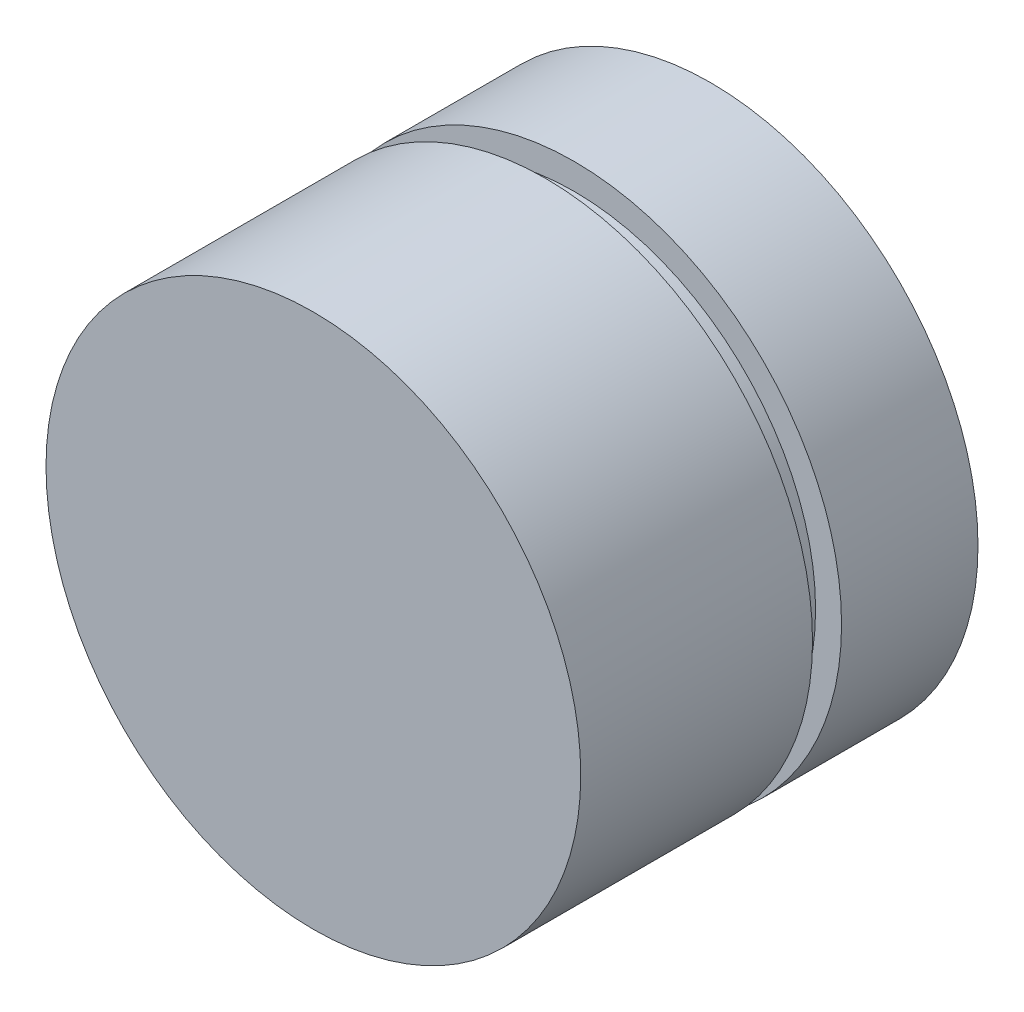
from build123d import *

# Parameters (mm, degrees)
CROQUIS8_W = 5
CROQUIS8_H = 6.1


with BuildPart() as part:
    # Croquis6 → Revolución1 (revolve)
    with BuildSketch(Plane(origin=(0, 0, 0), x_dir=(1, 0, 0), z_dir=(0, 1, 0))):
        Polygon((17.5, 15.169836957), (15.8, 15.169836957), (15.8, 17.069836957), (17.5, 17.069836957), (17.5, 26), (0, 26), (0, 0), (17.5, 0), align=None)
    revolve(axis=Axis((0, 0, 0), (0, 0, -1)))

    # Croquis7 → Cortar-Revolución1 (revolve, cut)
    with BuildSketch(Plane(origin=(0, 0, 0), x_dir=(1, 0, 0), z_dir=(0, 1, 0))):
        Polygon((0, 26.013313624), (15.6, 26.013313624), (15.6, 17.213313624), (13.88, 11.106656812), (0, 11.113313624), align=None)
    revolve(axis=Axis((0, 0, 0), (0, 0, -1)), mode=Mode.SUBTRACT)


with BuildPart() as body_2:
    # Croquis8 → Revolución4 (revolve)
    with BuildSketch(Plane(origin=(0, 0, 0), x_dir=(1, 0, 0), z_dir=(0, 1, 0))):
        with Locations((2.5, 14.163313624)):
            Rectangle(CROQUIS8_W, CROQUIS8_H)
    revolve(axis=Axis((0, 0, 0), (0, 0, -1)))


solid = Compound([part.part, body_2.part])
